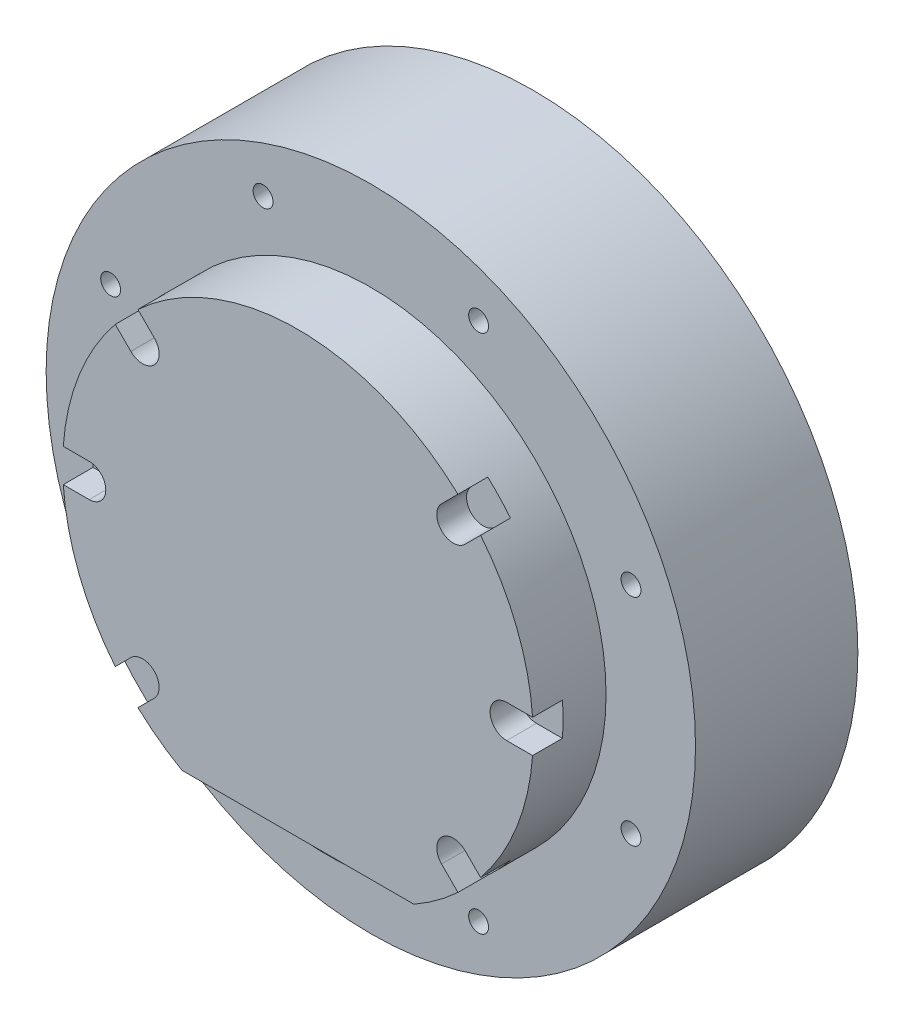
from build123d import *

# Parameters (mm, degrees)
SKETCH_1_W          = 35.5
SKETCH_1_H          = 11
SKETCH_1_W_2        = 18.5
SKETCH_1_H_2        = 1.7
CUT_EXTRUDE_1_REACH = 79.86
SKETCH_2_R          = 1.5
CUT_EXTRUDE_START   = -4.5
CUT_EXTRUDE_3_DEPTH = 4.5
SKETCH_4_R          = 2
SKETCH_4_R_2        = 1.5
CUT_EXTRUDE_4_DEPTH = 5


with BuildPart() as part:
    # 草图1 → 旋转1 (revolve)
    with BuildSketch(Plane(origin=(0, 0, 0), x_dir=(1, 0, 0), z_dir=(0, 1, 0))):
        Polygon((0, 24.5), (0, 0), (35.5, 0), (49, 0), (49, 24.5), (24, 24.5), align=None)
        with Locations((17.75, -5.5)):
            Rectangle(SKETCH_1_W, SKETCH_1_H)
        Polygon((0, 25.8), (0, 24.5), (24, 24.5), (24, 25.8), (18.5, 25.8), align=None)
        with Locations((9.25, 26.65)):
            Rectangle(SKETCH_1_W_2, SKETCH_1_H_2)
    revolve(axis=Axis((0, 0, 11), (0, 0, -1)))

    # 草图2 → 切除-拉伸1 (cut, up to next)
    with BuildSketch(Plane(origin=(0, 0, -24.5), x_dir=(-1, 0, 0), z_dir=(0, 0, -1)), mode=Mode.PRIVATE) as cut_extrude_1_sk1:
        with Locations((16.264045876, 39.264880132)):
            Circle(SKETCH_2_R)
    cut_extrude_1_tool1 = extrude(cut_extrude_1_sk1.sketch, amount=-CUT_EXTRUDE_1_REACH, mode=Mode.PRIVATE) & part.part
    # 草图2 → 切除-拉伸1 (cut, up to next)
    with BuildSketch(Plane(origin=(0, 0, -24.5), x_dir=(-1, 0, 0), z_dir=(0, 0, -1)), mode=Mode.PRIVATE) as cut_extrude_1_sk2:
        with Locations((-16.264045876, 39.264880132)):
            Circle(SKETCH_2_R)
    cut_extrude_1_tool2 = extrude(cut_extrude_1_sk2.sketch, amount=-CUT_EXTRUDE_1_REACH, mode=Mode.PRIVATE) & part.part
    # 草图2 → 切除-拉伸1 (cut, up to next)
    with BuildSketch(Plane(origin=(0, 0, -24.5), x_dir=(-1, 0, 0), z_dir=(0, 0, -1)), mode=Mode.PRIVATE) as cut_extrude_1_sk3:
        with Locations((-39.264880132, 16.264045876)):
            Circle(SKETCH_2_R)
    cut_extrude_1_tool3 = extrude(cut_extrude_1_sk3.sketch, amount=-CUT_EXTRUDE_1_REACH, mode=Mode.PRIVATE) & part.part
    # 草图2 → 切除-拉伸1 (cut, up to next)
    with BuildSketch(Plane(origin=(0, 0, -24.5), x_dir=(-1, 0, 0), z_dir=(0, 0, -1)), mode=Mode.PRIVATE) as cut_extrude_1_sk4:
        with Locations((-39.264880132, -16.264045876)):
            Circle(SKETCH_2_R)
    cut_extrude_1_tool4 = extrude(cut_extrude_1_sk4.sketch, amount=-CUT_EXTRUDE_1_REACH, mode=Mode.PRIVATE) & part.part
    # 草图2 → 切除-拉伸1 (cut, up to next)
    with BuildSketch(Plane(origin=(0, 0, -24.5), x_dir=(-1, 0, 0), z_dir=(0, 0, -1)), mode=Mode.PRIVATE) as cut_extrude_1_sk5:
        with Locations((-16.264045876, -39.264880132)):
            Circle(SKETCH_2_R)
    cut_extrude_1_tool5 = extrude(cut_extrude_1_sk5.sketch, amount=-CUT_EXTRUDE_1_REACH, mode=Mode.PRIVATE) & part.part
    # 草图2 → 切除-拉伸1 (cut, up to next)
    with BuildSketch(Plane(origin=(0, 0, -24.5), x_dir=(-1, 0, 0), z_dir=(0, 0, -1)), mode=Mode.PRIVATE) as cut_extrude_1_sk6:
        with Locations((16.264045876, -39.264880132)):
            Circle(SKETCH_2_R)
    cut_extrude_1_tool6 = extrude(cut_extrude_1_sk6.sketch, amount=-CUT_EXTRUDE_1_REACH, mode=Mode.PRIVATE) & part.part
    # 草图2 → 切除-拉伸1 (cut, up to next)
    with BuildSketch(Plane(origin=(0, 0, -24.5), x_dir=(-1, 0, 0), z_dir=(0, 0, -1)), mode=Mode.PRIVATE) as cut_extrude_1_sk7:
        with Locations((39.264880132, -16.264045876)):
            Circle(SKETCH_2_R)
    cut_extrude_1_tool7 = extrude(cut_extrude_1_sk7.sketch, amount=-CUT_EXTRUDE_1_REACH, mode=Mode.PRIVATE) & part.part
    # 草图2 → 切除-拉伸1 (cut, up to next)
    with BuildSketch(Plane(origin=(0, 0, -24.5), x_dir=(-1, 0, 0), z_dir=(0, 0, -1)), mode=Mode.PRIVATE) as cut_extrude_1_sk8:
        with Locations((39.264880132, 16.264045876)):
            Circle(SKETCH_2_R)
    cut_extrude_1_tool8 = extrude(cut_extrude_1_sk8.sketch, amount=-CUT_EXTRUDE_1_REACH, mode=Mode.PRIVATE) & part.part
    add(cut_extrude_1_tool1.solids().sort_by_distance((-16.264046, 39.26488, -24.5))[0], mode=Mode.SUBTRACT)
    add(cut_extrude_1_tool2.solids().sort_by_distance((16.264046, 39.26488, -24.5))[0], mode=Mode.SUBTRACT)
    add(cut_extrude_1_tool3.solids().sort_by_distance((39.26488, 16.264046, -24.5))[0], mode=Mode.SUBTRACT)
    add(cut_extrude_1_tool4.solids().sort_by_distance((39.26488, -16.264046, -24.5))[0], mode=Mode.SUBTRACT)
    add(cut_extrude_1_tool5.solids().sort_by_distance((16.264046, -39.26488, -24.5))[0], mode=Mode.SUBTRACT)
    add(cut_extrude_1_tool6.solids().sort_by_distance((-16.264046, -39.26488, -24.5))[0], mode=Mode.SUBTRACT)
    add(cut_extrude_1_tool7.solids().sort_by_distance((-39.26488, -16.264046, -24.5))[0], mode=Mode.SUBTRACT)
    add(cut_extrude_1_tool8.solids().sort_by_distance((-39.26488, 16.264046, -24.5))[0], mode=Mode.SUBTRACT)

    # 草图3 → 切除-拉伸3 (cut)
    with BuildSketch(Plane.XY.offset(11).offset(CUT_EXTRUDE_START)):
        with BuildLine():
            Line((-38.5, 2.5), (-31.5, 2.5))
            ThreePointArc((-31.5, 2.5), (-29, 0), (-31.5, -2.5))
            Line((-31.5, -2.5), (-38.5, -2.5))
            ThreePointArc((-38.5, -2.5), (-41, 0), (-38.5, 2.5))
        make_face()
        with BuildLine():
            Line((-17.5, -30.886890423), (17.5, -30.886890423))
            ThreePointArc((17.5, -30.886890423), (0, -35.5), (-17.5, -30.886890423))
        make_face()
        with BuildLine():
            Line((-30.16456452, -24.962082865), (-25.214817051, -20.012335396))
            ThreePointArc((-25.214817051, -20.012335396), (-21.679283146, -20.012335396), (-21.679283146, -23.547869302))
            Line((-21.679283146, -23.547869302), (-26.629030614, -28.497616771))
            ThreePointArc((-26.629030614, -28.497616771), (-30.16456452, -28.497616771), (-30.16456452, -24.962082865))
        make_face()
        with BuildLine():
            Line((30.16456452, -24.962082865), (25.214817051, -20.012335396))
            ThreePointArc((25.214817051, -20.012335396), (21.679283146, -20.012335396), (21.679283146, -23.547869302))
            Line((21.679283146, -23.547869302), (26.629030614, -28.497616771))
            ThreePointArc((26.629030614, -28.497616771), (30.16456452, -28.497616771), (30.16456452, -24.962082865))
        make_face()
        with BuildLine():
            Line((38.5, 2.5), (31.5, 2.5))
            ThreePointArc((31.5, 2.5), (29, 0), (31.5, -2.5))
            Line((31.5, -2.5), (38.5, -2.5))
            ThreePointArc((38.5, -2.5), (41, 0), (38.5, 2.5))
        make_face()
        with BuildLine():
            Line((-30.16456452, 24.962082865), (-25.214817051, 20.012335396))
            ThreePointArc((-25.214817051, 20.012335396), (-21.679283146, 20.012335396), (-21.679283146, 23.547869302))
            Line((-21.679283146, 23.547869302), (-26.629030614, 28.497616771))
            ThreePointArc((-26.629030614, 28.497616771), (-30.16456452, 28.497616771), (-30.16456452, 24.962082865))
        make_face()
        with BuildLine():
            Line((30.16456452, 24.962082865), (25.214817051, 20.012335396))
            ThreePointArc((25.214817051, 20.012335396), (21.679283146, 20.012335396), (21.679283146, 23.547869302))
            Line((21.679283146, 23.547869302), (26.629030614, 28.497616771))
            ThreePointArc((26.629030614, 28.497616771), (30.16456452, 28.497616771), (30.16456452, 24.962082865))
        make_face()
    extrude(amount=CUT_EXTRUDE_3_DEPTH, mode=Mode.SUBTRACT)

    # 草图4 → 切除-拉伸4 (cut)
    with BuildSketch(Plane(origin=(0, 0, -27.5), x_dir=(-1, 0, 0), z_dir=(0, 0, -1))):
        with Locations((7, 12.124355653)):
            Circle(SKETCH_4_R)
        with Locations((14, 0)):
            Circle(SKETCH_4_R)
        with Locations((7, -12.124355653)):
            Circle(SKETCH_4_R)
        with Locations((-7, -12.124355653)):
            Circle(SKETCH_4_R)
        with Locations((-14, 0)):
            Circle(SKETCH_4_R)
        with Locations((-7, 12.124355653)):
            Circle(SKETCH_4_R)
        with Locations((0, 14)):
            Circle(SKETCH_4_R_2)
        with Locations((0, -14)):
            Circle(SKETCH_4_R_2)
    extrude(amount=-CUT_EXTRUDE_4_DEPTH, mode=Mode.SUBTRACT)


solid = part.part
